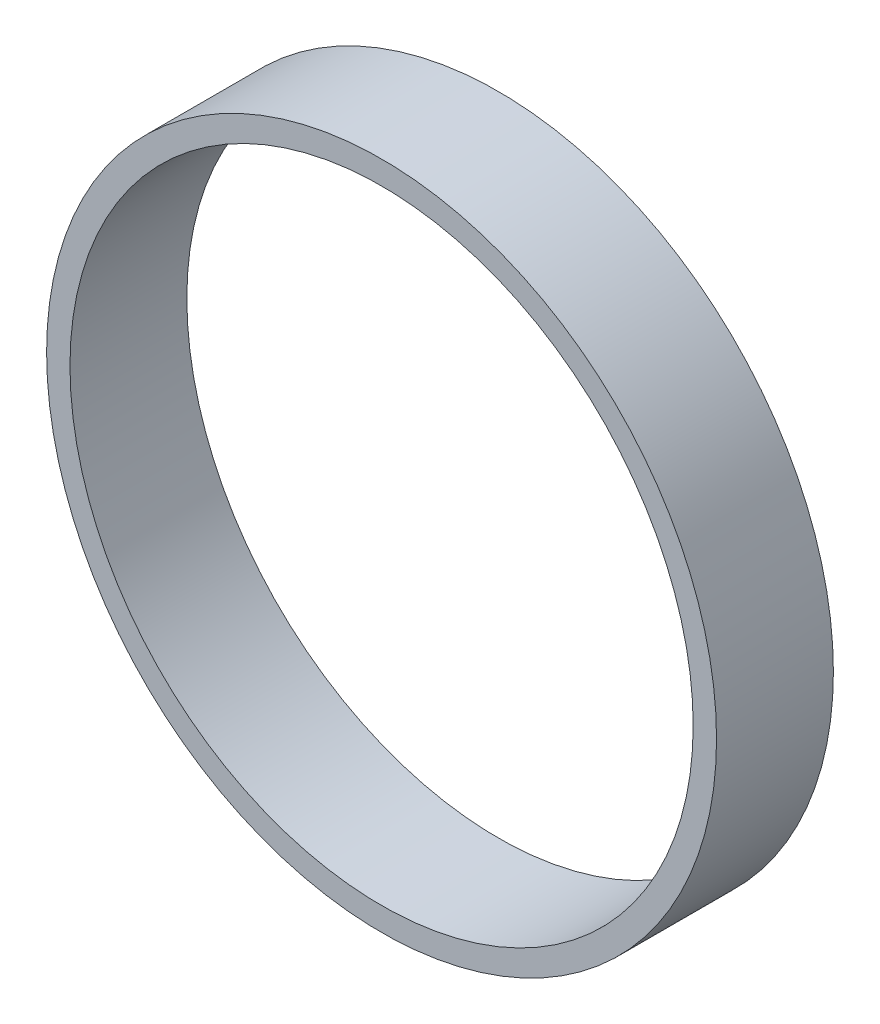
from build123d import *

# Parameters (mm, degrees)
SKETCH1_R           = 54.61
SKETCH1_R_2         = 50.8
BOSS_EXTRUDE1_DEPTH = 19.05


with BuildPart() as part:
    # Sketch1 → Boss-Extrude1 (new body)
    with BuildSketch(Plane.XY):
        with Locations(Location((0, 0, 0), (0, 0, 180))):
            Circle(SKETCH1_R)
        with Locations(Location((0, 0, 0), (0, 0, 180))):
            Circle(SKETCH1_R_2, mode=Mode.SUBTRACT)
    extrude(amount=BOSS_EXTRUDE1_DEPTH)


solid = part.part
